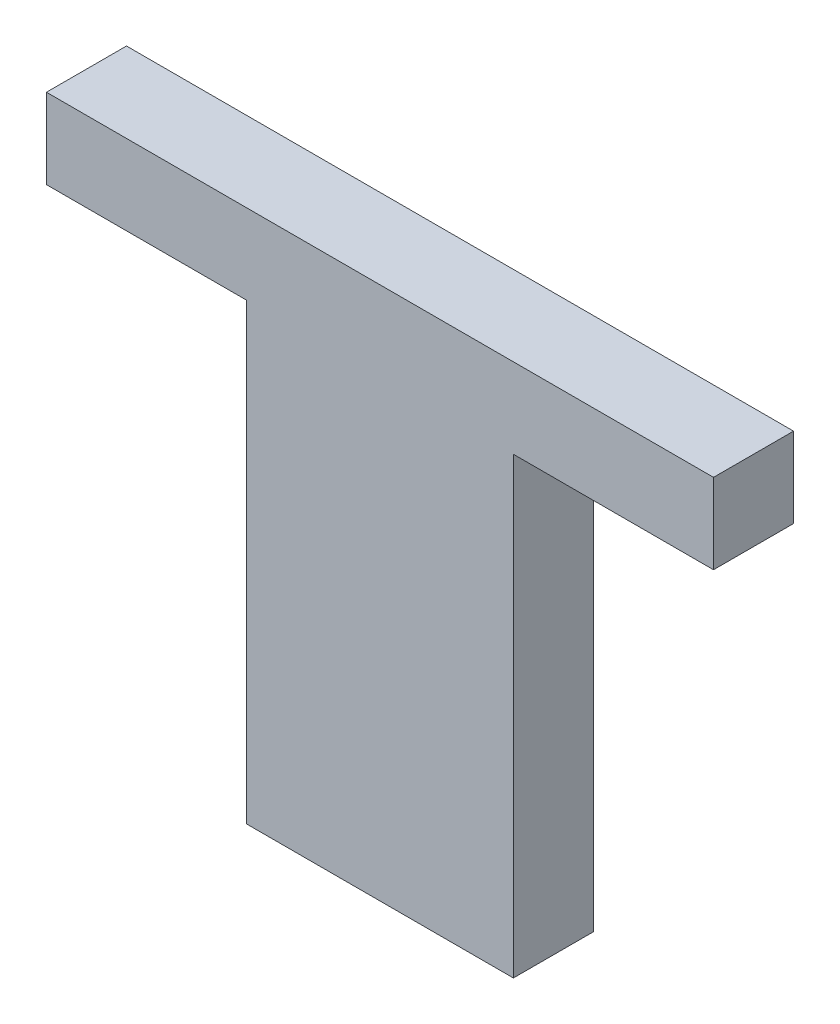
from build123d import *

# Parameters (mm, degrees)
ESQUISSE1_W             = 50
ESQUISSE1_H             = 40
BOSS_EXTRU_1_DEPTH      = 6
ESQUISSE2_W             = 15
ESQUISSE2_H             = 34
ENL_V_MAT_EXTRU_1_DEPTH = 6


with BuildPart() as part:
    # Esquisse1 → Boss.-Extru.1 (new body)
    with BuildSketch(Plane.XY):
        with Locations((25, 20)):
            Rectangle(ESQUISSE1_W, ESQUISSE1_H)
    extrude(amount=BOSS_EXTRU_1_DEPTH)

    # Esquisse2 → Enlèv. mat.-Extru.1 (cut)
    with BuildSketch(Plane.XY.offset(6)):
        with Locations((7.5, 17)):
            Rectangle(ESQUISSE2_W, ESQUISSE2_H)
        with Locations((42.5, 17)):
            Rectangle(ESQUISSE2_W, ESQUISSE2_H)
    extrude(amount=-ENL_V_MAT_EXTRU_1_DEPTH, mode=Mode.SUBTRACT)


solid = part.part
